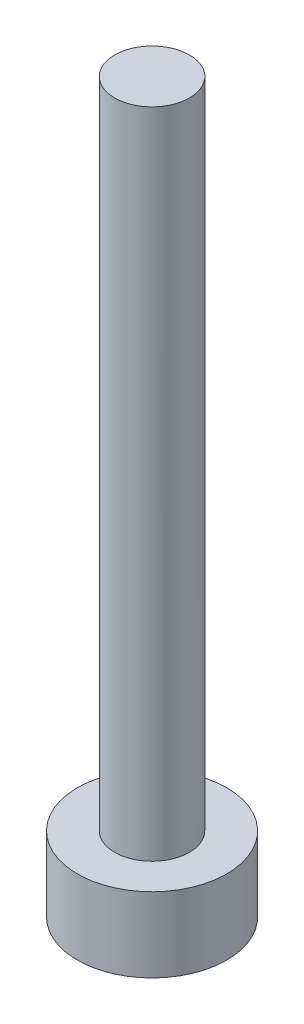
from build123d import *

# Parameters (mm, degrees)
SKETCH_1_R      = 2
EXTRUDE_1_DEPTH = 35
SKETCH_2_R      = 4
EXTRUDE_2_DEPTH = 4


with BuildPart() as part:
    # 草图1 → 凸台-拉伸1 (new body)
    with BuildSketch(Plane(origin=(0, 0, 0), x_dir=(1, 0, 0), z_dir=(0, 1, 0))):
        with Locations(Location((0, 0, 0), (0, 0, 270))):
            Circle(SKETCH_1_R)
    extrude(amount=EXTRUDE_1_DEPTH)

    # 草图2 → 凸台-拉伸2 (add)
    with BuildSketch(Plane.XZ):
        with Locations(Location((0, 0, 0), (0, 0, 270))):
            Circle(SKETCH_2_R)
    extrude(amount=EXTRUDE_2_DEPTH)


solid = part.part
